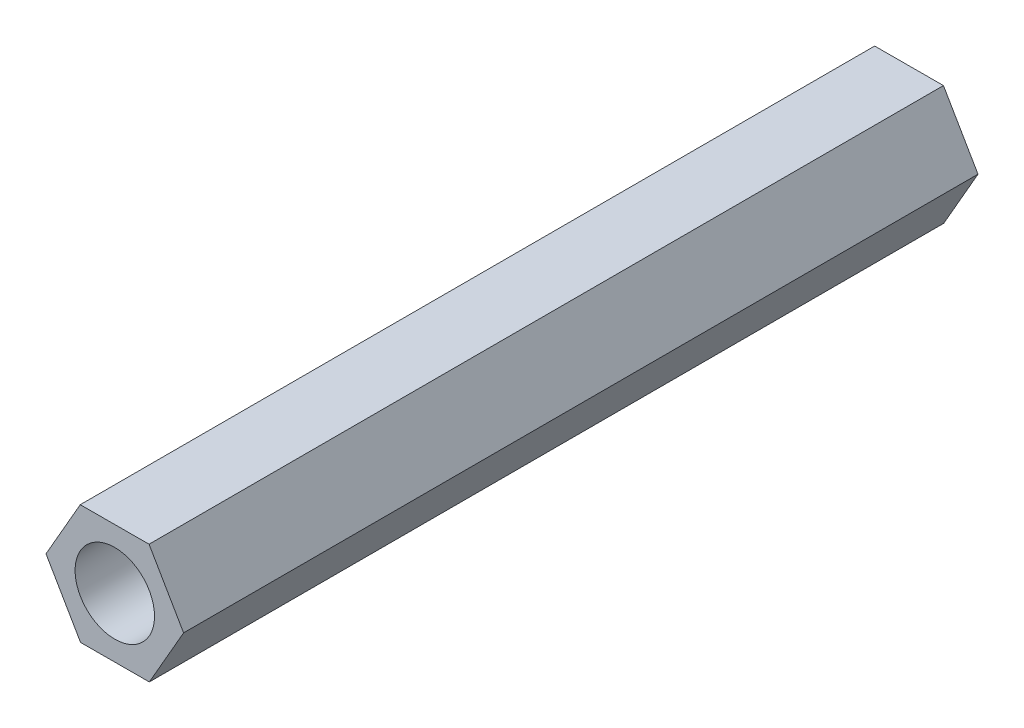
from build123d import *

# Parameters (mm, degrees)
SKETCH_1_R      = 2
EXTRUDE_1_DEPTH = 40


with BuildPart() as part:
    # 草图1 → 凸台-拉伸1 (new body)
    with BuildSketch(Plane.XY):
        Polygon((1.739148844, -2.995890736), (3.464091906, 0.008201712), (1.724943062, 3.004092447), (-1.739148844, 2.995890736), (-3.464091906, -0.008201712), (-1.724943062, -3.004092447), align=None)
        Circle(SKETCH_1_R, mode=Mode.SUBTRACT)
    extrude(amount=EXTRUDE_1_DEPTH)


solid = part.part
